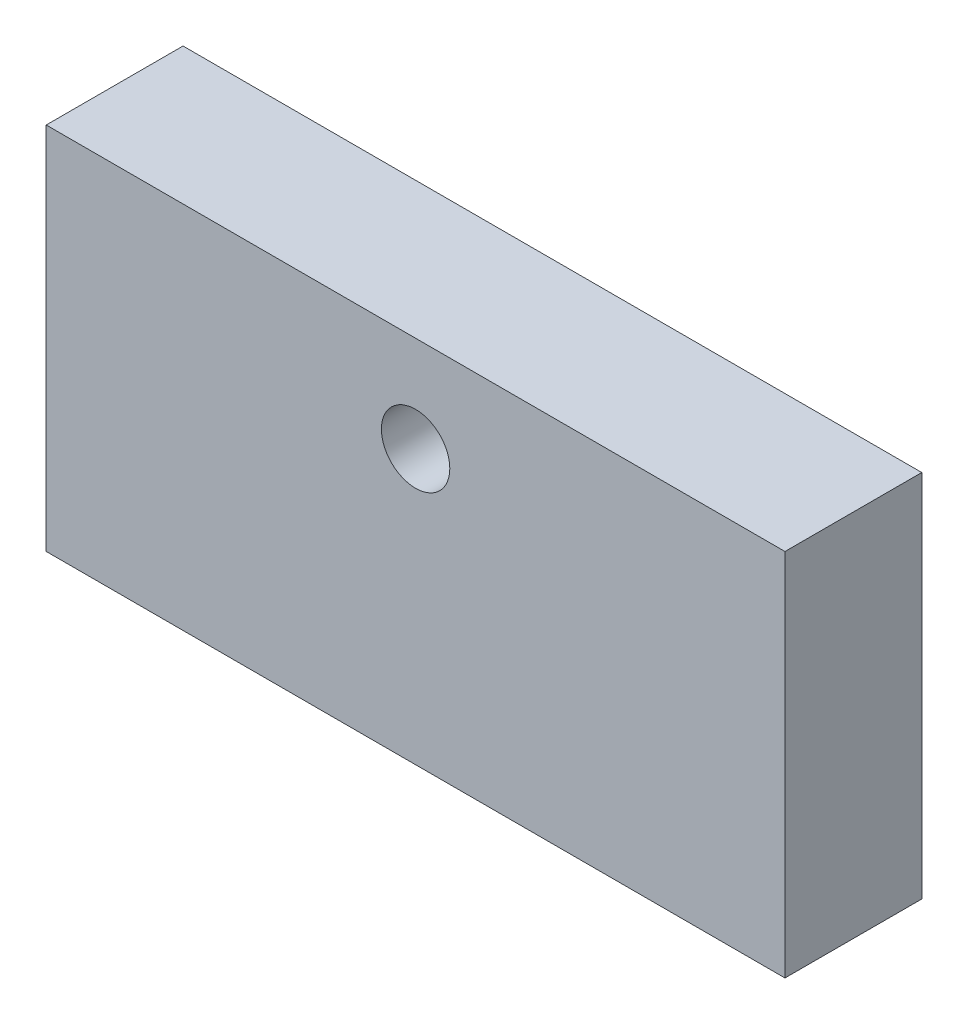
from build123d import *

# Parameters (mm, degrees)
SKETCH_1_W             = 54
SKETCH_1_H             = 27
EXTRUDE_1_DEPTH        = 10
HOLE_WIZARD_M6_1_D     = 5
HOLE_WIZARD_M6_1_DEPTH = 15
HOLE_WIZARD_M6_1_TIP   = 1.502151548


with BuildPart() as part:
    # 草图1 → 凸台-拉伸1 (new body)
    with BuildSketch(Plane.XY):
        with Locations((27, 13.5)):
            Rectangle(SKETCH_1_W, SKETCH_1_H)
    extrude(amount=EXTRUDE_1_DEPTH)

    # M6 螺纹孔1
    with Locations(Plane.XY.offset(10)):
        with Locations((27, 20)):
            Hole(HOLE_WIZARD_M6_1_D / 2, depth=HOLE_WIZARD_M6_1_DEPTH)
            with Locations((0, 0, -(HOLE_WIZARD_M6_1_DEPTH + HOLE_WIZARD_M6_1_TIP / 2))):  # 118° drill point
                Cone(0, HOLE_WIZARD_M6_1_D / 2, HOLE_WIZARD_M6_1_TIP, mode=Mode.SUBTRACT)


solid = part.part
